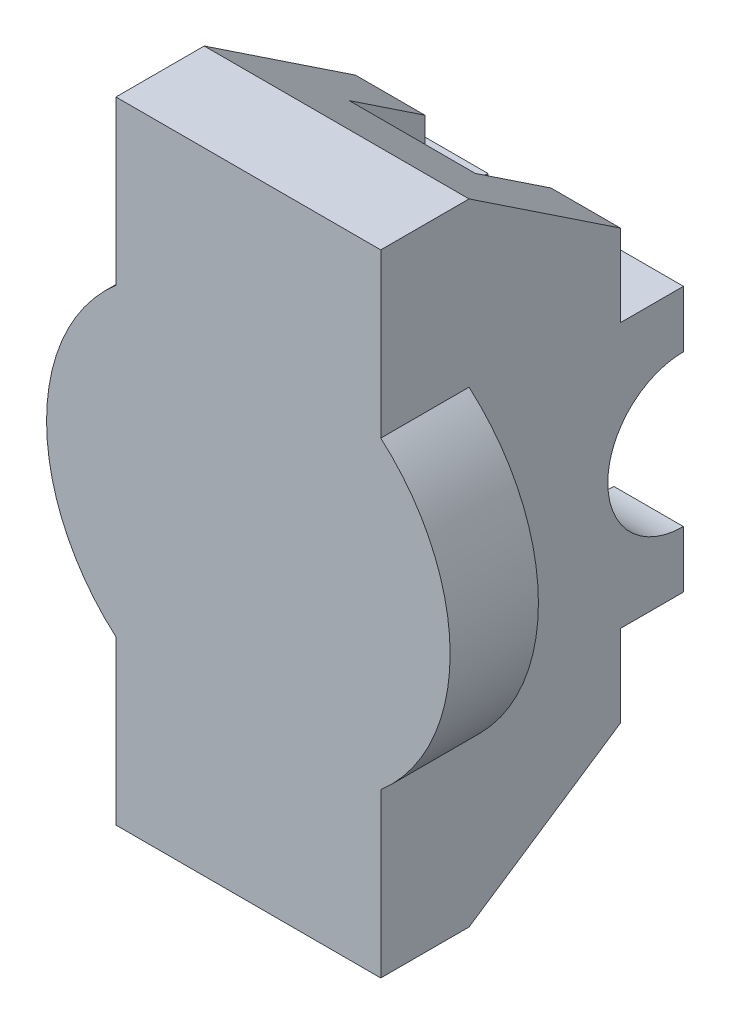
from build123d import *

# Parameters (mm, degrees)
SKETCH1_W           = 42
SKETCH1_H           = 100
BOSS_EXTRUDE2_DEPTH = 14
BOSS_EXTRUDE3_DEPTH = 14
BOSS_EXTRUDE4_DEPTH = 11
SKETCH11_W          = 20
SKETCH11_H          = 12
BOSS_EXTRUDE5_DEPTH = 100
CUT_EXTRUDE1_DEPTH  = 74.620649277


with BuildPart() as part:
    # Sketch1 → Boss-Extrude2 (new body)
    with BuildSketch(Plane.XY):
        Rectangle(SKETCH1_W, SKETCH1_H)
    extrude(amount=BOSS_EXTRUDE2_DEPTH)

    # Sketch3 → Boss-Extrude3 (add)
    with BuildSketch(Plane.XY.offset(14)):
        with BuildLine():
            Line((-21, 24.145392935), (-21, -24.145392935))
            ThreePointArc((-21, -24.145392935), (-32, 0), (-21, 24.145392935))
        make_face()
        with BuildLine():
            Line((21, 24.145392935), (21, -24.145392935))
            ThreePointArc((21, -24.145392935), (32, 0), (21, 24.145392935))
        make_face()
    extrude(amount=-BOSS_EXTRUDE3_DEPTH)

    # Sketch4 → Boss-Extrude4 (add)
    with BuildSketch(Plane(origin=(21, 0, 0), x_dir=(0, 0, -1), z_dir=(1, 0, 0))):
        with BuildLine():
            Line((34, 12), (34, 21))
            Line((34, 21), (24, 21))
            Line((24, 21), (24, 34))
            Line((24, 34), (0, 50))
            Line((0, 50), (0, -50))
            Line((0, -50), (24, -34))
            Line((24, -34), (24, -21))
            Line((24, -21), (34, -21))
            Line((34, -21), (34, -12))
            ThreePointArc((34, -12), (22, 0), (34, 12))
        make_face()
    boss_extrude4 = extrude(amount=-BOSS_EXTRUDE4_DEPTH)

    # Mirror1: Boss-Extrude4 across plane
    add(boss_extrude4.mirror(Plane(origin=(0, 0, 0), x_dir=(0, 0, 1), z_dir=(1, 0, 0))))

    # Sketch11 → Boss-Extrude5 (add, through all)
    with BuildSketch(Plane(origin=(0, 50, 0), x_dir=(1, 0, 0), z_dir=(0, 1, 0))):
        with Locations((0, 6)):
            Rectangle(SKETCH11_W, SKETCH11_H)
    extrude(amount=-BOSS_EXTRUDE5_DEPTH)

    # Sketch12 → Cut-Extrude1 (cut, through all)
    with BuildSketch(Plane(origin=(10, 0, 0), x_dir=(0, 0, -1), z_dir=(1, 0, 0))):
        Polygon((0, 50), (12, 42), (12, 50), align=None)
    cut_extrude1 = extrude(amount=-CUT_EXTRUDE1_DEPTH, mode=Mode.SUBTRACT)

    # Mirror2: Cut-Extrude1 across plane
    add(cut_extrude1.mirror(Plane.ZX), mode=Mode.SUBTRACT)


solid = part.part
